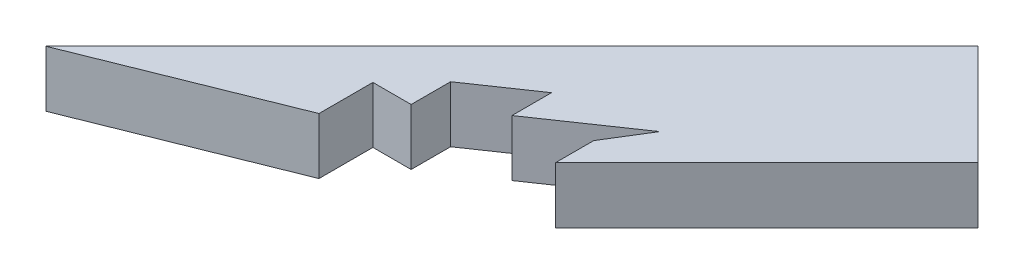
from build123d import *

# Parameters (mm, degrees)
BOSS_EXTRUDE1_DEPTH = 12.7


with BuildPart() as part:
    # Sketch1 → Boss-Extrude1 (new body)
    with BuildSketch(Plane(origin=(0, 0, 0), x_dir=(1, 0, 0), z_dir=(0, 1, 0))):
        Polygon((-112.504360112, -43.31613865), (-7.44802384, 61.740197623), (15.288048935, 39.004124847), (-32.340103517, -8.624027604), (-32.340103517, 0), (-26.656085323, 9.212029487), (-46.452148688, -4.312013802), (-46.452148688, 4.606014743), (-59.976191976, -4.633183147), (-59.976191976, -13.524043289), (-68.600219581, -13.524043289), (-68.600219581, -25.676082186), align=None)
    extrude(amount=BOSS_EXTRUDE1_DEPTH)


solid = part.part
